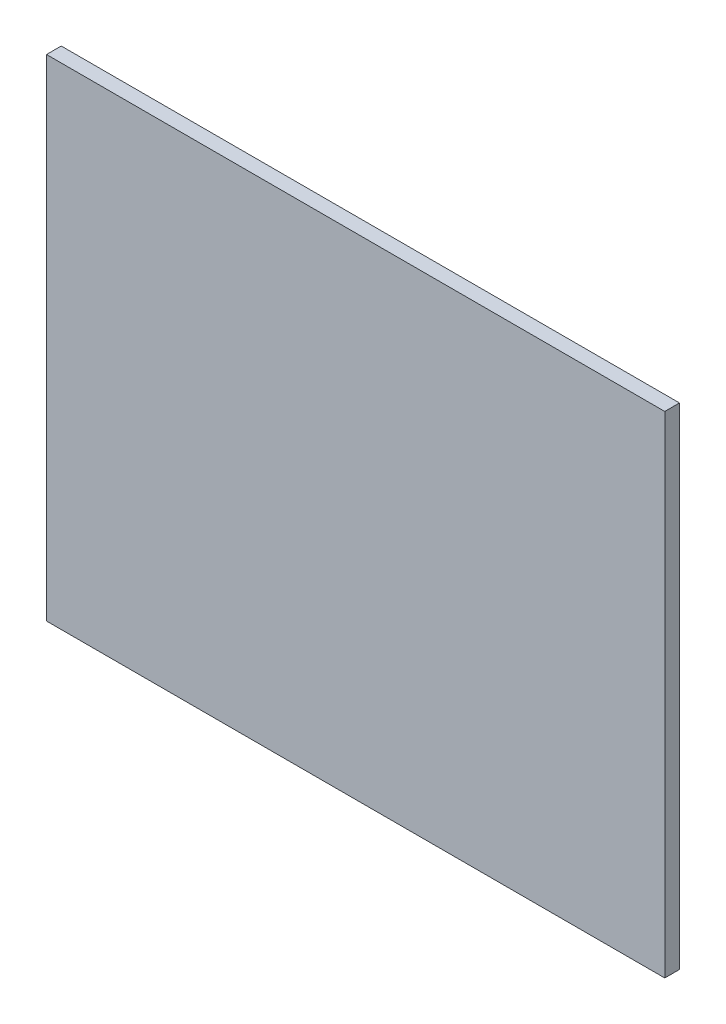
from build123d import *

# Parameters (mm, degrees)
SKETCH1_W           = 63
SKETCH1_H           = 50
BOSS_EXTRUDE1_DEPTH = 1.5


with BuildPart() as part:
    # Sketch1 → Boss-Extrude1 (new body)
    with BuildSketch(Plane.XY):
        with Locations((5.836104513, 1.112826603)):
            Rectangle(SKETCH1_W, SKETCH1_H)
    extrude(amount=BOSS_EXTRUDE1_DEPTH)


solid = part.part
